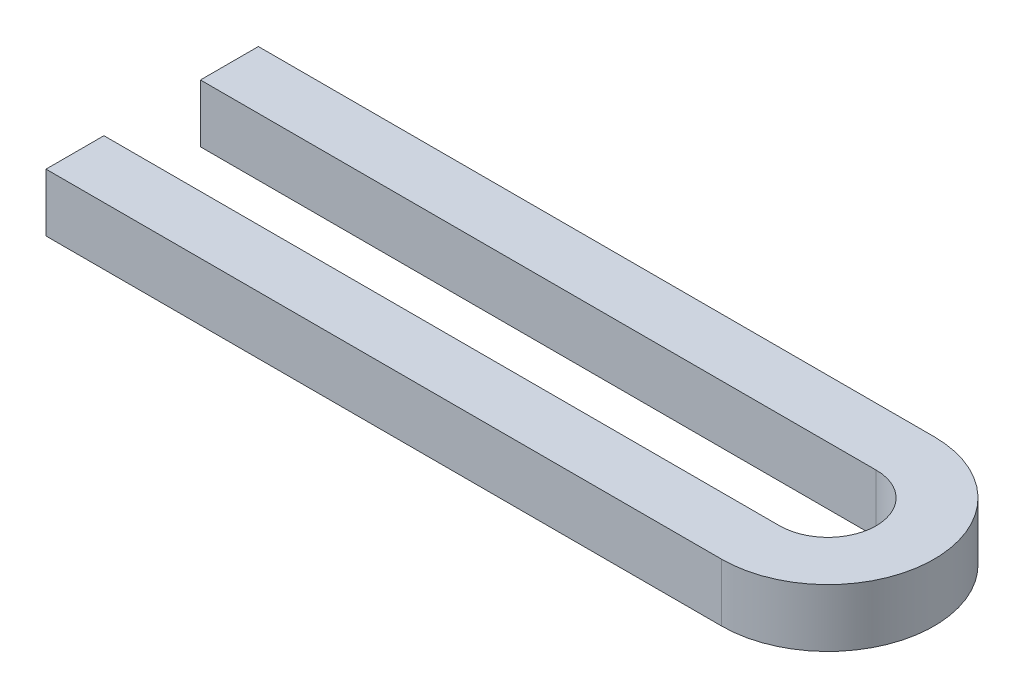
from build123d import *

# Parameters (mm, degrees)
EXTRUDE_1_DEPTH = 3


with BuildPart() as part:
    # 草图1 → 凸台-拉伸1 (new body)
    with BuildSketch(Plane(origin=(0, 0, 0), x_dir=(1, 0, 0), z_dir=(0, 1, 0))):
        with BuildLine():
            Line((0, 2.5), (-35, 2.5))
            Line((-35, 2.5), (-35, 5.5))
            Line((-35, 5.5), (0, 5.5))
            ThreePointArc((0, 5.5), (5.5, 0), (0, -5.5))
            Line((0, -5.5), (-35, -5.5))
            Line((-35, -5.5), (-35, -2.5))
            Line((-35, -2.5), (0, -2.5))
            ThreePointArc((0, -2.5), (2.5, 0), (0, 2.5))
        make_face()
    extrude(amount=EXTRUDE_1_DEPTH)


solid = part.part
